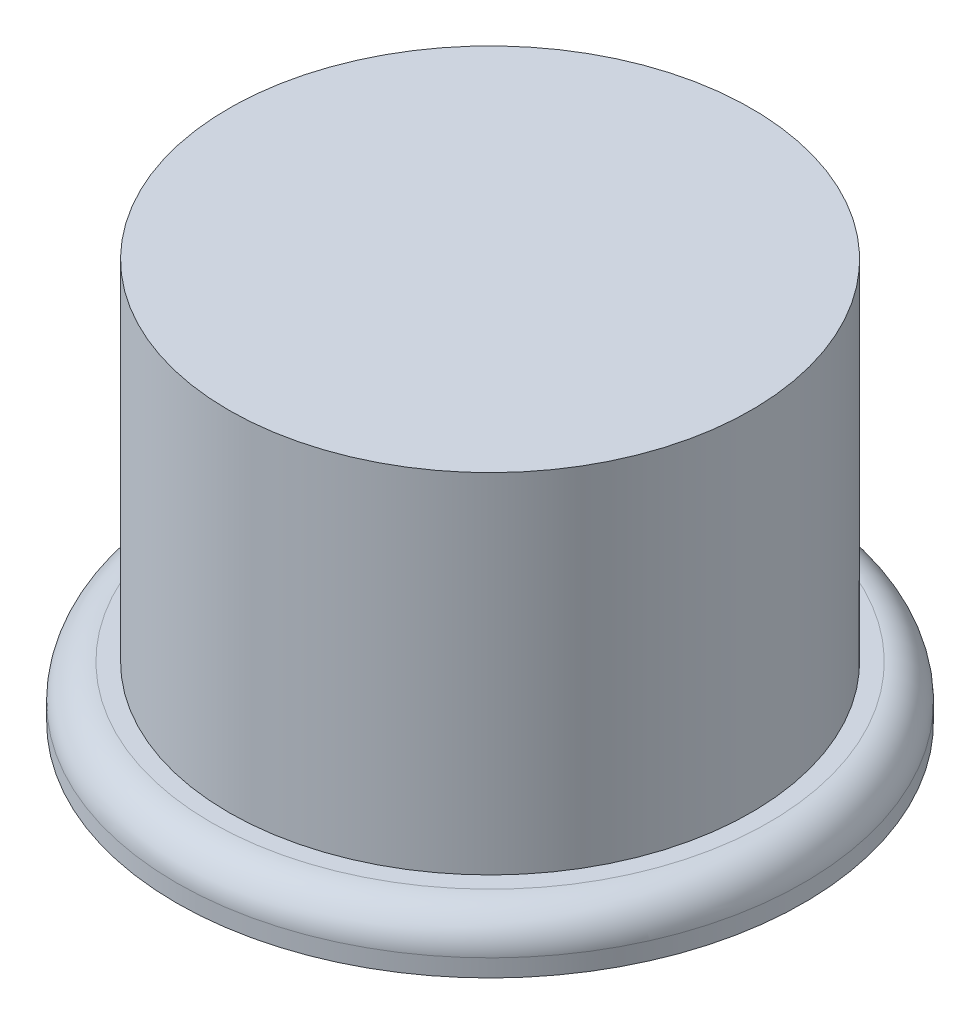
from build123d import *

# Parameters (mm, degrees)
ESBO_O1_R                = 9
RESSALTO_EXTRUS_O1_DEPTH = 1.5
FILETE1_R                = 1
ESBO_O2_R                = 7.5
RESSALTO_EXTRUS_O2_DEPTH = 10


with BuildPart() as part:
    # Esboço1 → Ressalto-extrusão1 (new body)
    with BuildSketch(Plane(origin=(0, 0, 0), x_dir=(1, 0, 0), z_dir=(0, 1, 0))):
        with Locations(Location((0, 0, 0), (0, 0, 270))):
            Circle(ESBO_O1_R)
    extrude(amount=RESSALTO_EXTRUS_O1_DEPTH)

    # Filete1
    filete1_edges = [part.edges().sort_by_distance(p)[0] for p in [
        (0, 1.5, -9),
    ]]
    fillet(filete1_edges, radius=FILETE1_R)

    # Esboço2 → Ressalto-extrusão2 (add)
    with BuildSketch(Plane(origin=(0, 1.5, 0), x_dir=(1, 0, 0), z_dir=(0, 1, 0))):
        with Locations(Location((0, 0, 0), (0, 0, 270))):
            Circle(ESBO_O2_R)
    extrude(amount=RESSALTO_EXTRUS_O2_DEPTH)


solid = part.part
